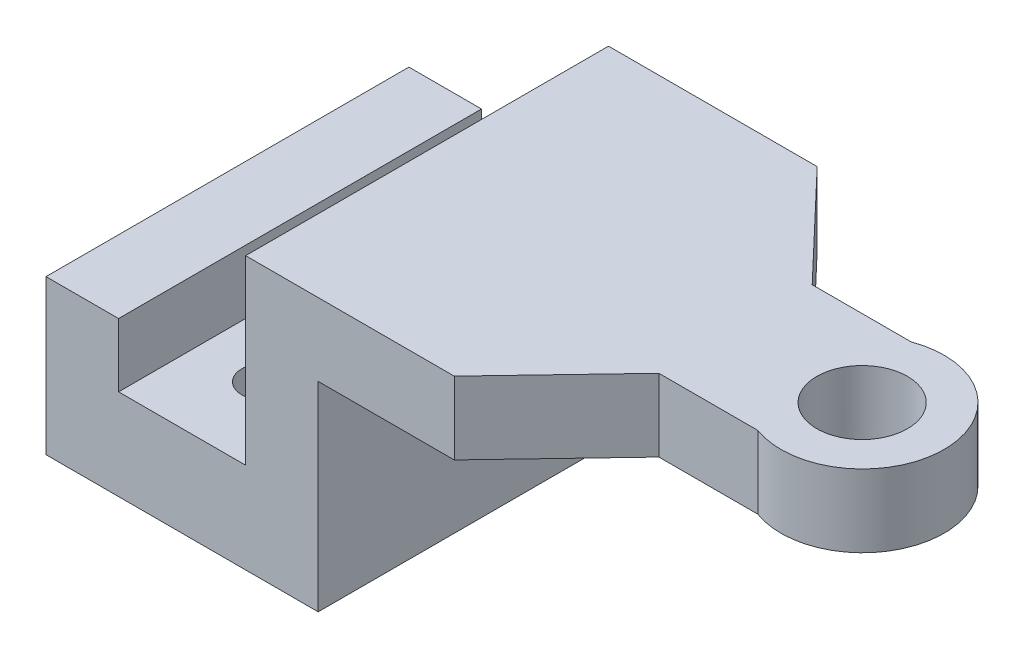
from build123d import *

# Parameters (mm, degrees)
BOSS_EXTRUDE3_DEPTH = 150
SKETCH6_R           = 12.5
CUT_EXTRUDE3_DEPTH  = 50
SKETCH7_R           = 25
CUT_EXTRUDE4_DEPTH  = 20
SKETCH8_R           = 12.5
CUT_EXTRUDE7_DEPTH  = 50
SKETCH11_R          = 25
CUT_EXTRUDE8_DEPTH  = 20
SKETCH12_R          = 25
CUT_EXTRUDE9_DEPTH  = 150
SKETCH14_W          = 40
SKETCH14_H          = 200
CUT_EXTRUDE10_DEPTH = 65
SKETCH15_W          = 70
SKETCH15_H          = 200
CUT_EXTRUDE11_DEPTH = 100
CUT_EXTRUDE12_DEPTH = 110


with BuildPart() as part:
    # Sketch2 → Boss-Extrude3 (new body)
    with BuildSketch(Plane(origin=(0, 0, 0), x_dir=(1, 0, 0), z_dir=(0, 1, 0))):
        with BuildLine():
            Line((0, 0), (0, 200))
            Line((0, 200), (225, 200))
            Line((225, 200), (280, 142.246569699))
            Line((280, 142.246569699), (334.500730705, 142.246569699))
            ThreePointArc((334.500730705, 142.246569699), (395, 100), (334.500730705, 57.753430301))
            Line((334.500730705, 57.753430301), (280, 57.753430301))
            Line((280, 57.753430301), (225, 0))
            Line((225, 0), (0, 0))
        make_face()
    extrude(amount=BOSS_EXTRUDE3_DEPTH)

    # Sketch6 → Cut-Extrude3 (cut)
    with BuildSketch(Plane.XZ):
        with Locations(Location((75.424439909, -45, 0), (0, 0, 270))):
            Circle(SKETCH6_R)
    extrude(amount=-CUT_EXTRUDE3_DEPTH, mode=Mode.SUBTRACT)

    # Sketch7 → Cut-Extrude4 (cut)
    with BuildSketch(Plane.XZ):
        with Locations(Location((75.424439909, -45, 0), (0, 0, 270))):
            Circle(SKETCH7_R)
    extrude(amount=-CUT_EXTRUDE4_DEPTH, mode=Mode.SUBTRACT)

    # Sketch8 → Cut-Extrude7 (cut)
    with BuildSketch(Plane.XZ):
        with Locations(Location((75, -155, 0), (0, 0, 270))):
            Circle(SKETCH8_R)
    extrude(amount=-CUT_EXTRUDE7_DEPTH, mode=Mode.SUBTRACT)

    # Sketch11 → Cut-Extrude8 (cut)
    with BuildSketch(Plane(origin=(0, 0, 0), x_dir=(-1, 0, 0), z_dir=(0, -1, 0))):
        with Locations(Location((-75, 155, 0), (0, 0, 90))):
            Circle(SKETCH11_R)
    extrude(amount=-CUT_EXTRUDE8_DEPTH, mode=Mode.SUBTRACT)

    # Sketch12 → Cut-Extrude9 (cut)
    with BuildSketch(Plane(origin=(0, 0, 0), x_dir=(-1, 0, 0), z_dir=(0, -1, 0))):
        with Locations(Location((-350, 99.787780046, 0), (0, 0, 90))):
            Circle(SKETCH12_R)
    extrude(amount=-CUT_EXTRUDE9_DEPTH, mode=Mode.SUBTRACT)

    # Sketch14 → Cut-Extrude10 (cut)
    with BuildSketch(Plane(origin=(0, 150, 0), x_dir=(1, 0, 0), z_dir=(0, 1, 0))):
        with Locations((20, 100)):
            Rectangle(SKETCH14_W, SKETCH14_H)
    extrude(amount=-CUT_EXTRUDE10_DEPTH, mode=Mode.SUBTRACT)

    # Sketch15 → Cut-Extrude11 (cut)
    with BuildSketch(Plane(origin=(0, 150, 0), x_dir=(1, 0, 0), z_dir=(0, 1, 0))):
        with Locations((75, 100)):
            Rectangle(SKETCH15_W, SKETCH15_H)
    extrude(amount=-CUT_EXTRUDE11_DEPTH, mode=Mode.SUBTRACT)

    # Sketch16 → Cut-Extrude12 (cut)
    with BuildSketch(Plane.XZ):
        with BuildLine():
            Line((150, -200), (150, 0))
            Line((150, 0), (225, 0))
            Line((225, 0), (280, -57.753430301))
            Line((280, -57.753430301), (334.500730705, -57.753430301))
            ThreePointArc((334.500730705, -57.753430301), (395, -100), (334.500730705, -142.246569699))
            Line((334.500730705, -142.246569699), (280, -142.246569699))
            Line((280, -142.246569699), (225, -200))
            Line((225, -200), (150, -200))
        make_face()
    extrude(amount=-CUT_EXTRUDE12_DEPTH, mode=Mode.SUBTRACT)


solid = part.part
